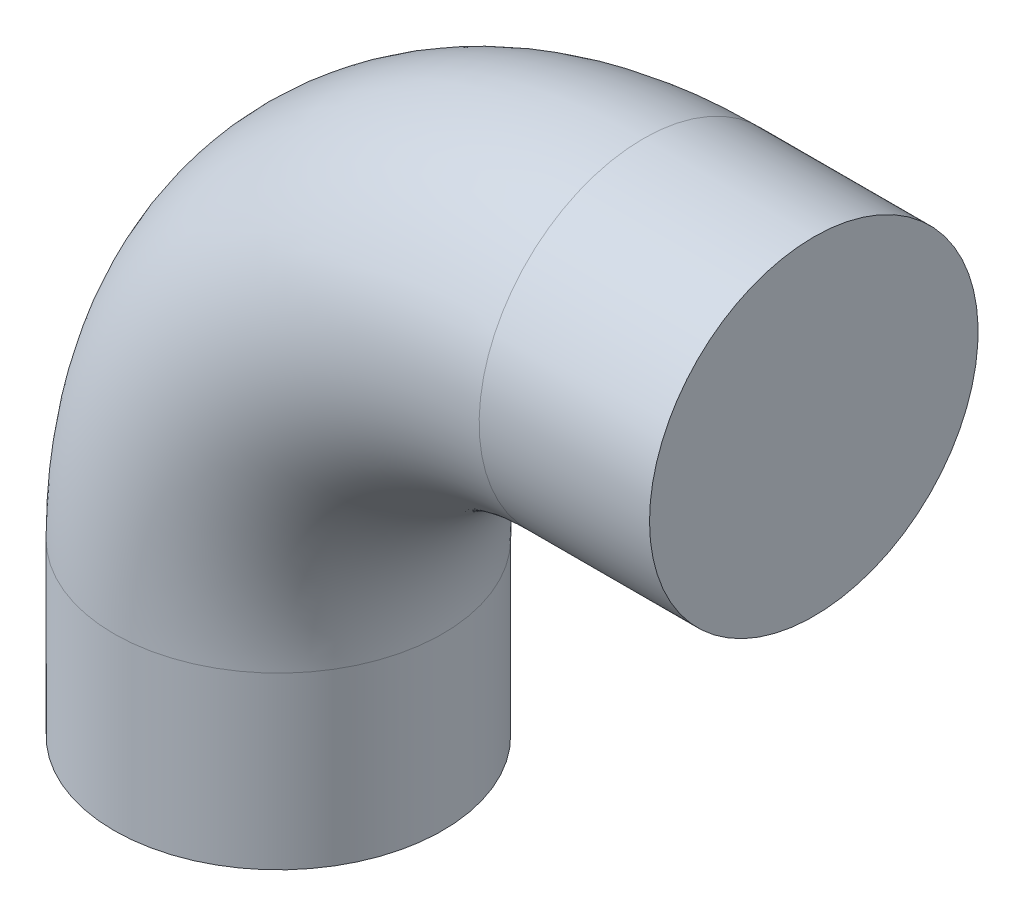
from build123d import *

# Parameters (mm, degrees)
SKETCH2_R = 6.75


with BuildPart() as part:
    # Sweep1: sweep along a path in Sketch1
    with BuildLine(Plane.XY) as sweep1_path:
        Line((0, 0), (0, 7))
        ThreePointArc((0, 7), (4.393398282, 17.606601718), (15, 22))
        Line((15, 22), (22, 22))
    # Sketch2 → Sweep1 (sweep)
    with BuildSketch(Plane(origin=(0, 0, 0), x_dir=(1, 0, 0), z_dir=(0, 1, 0))):
        Circle(SKETCH2_R)
    sweep(path=sweep1_path.line)


solid = part.part
